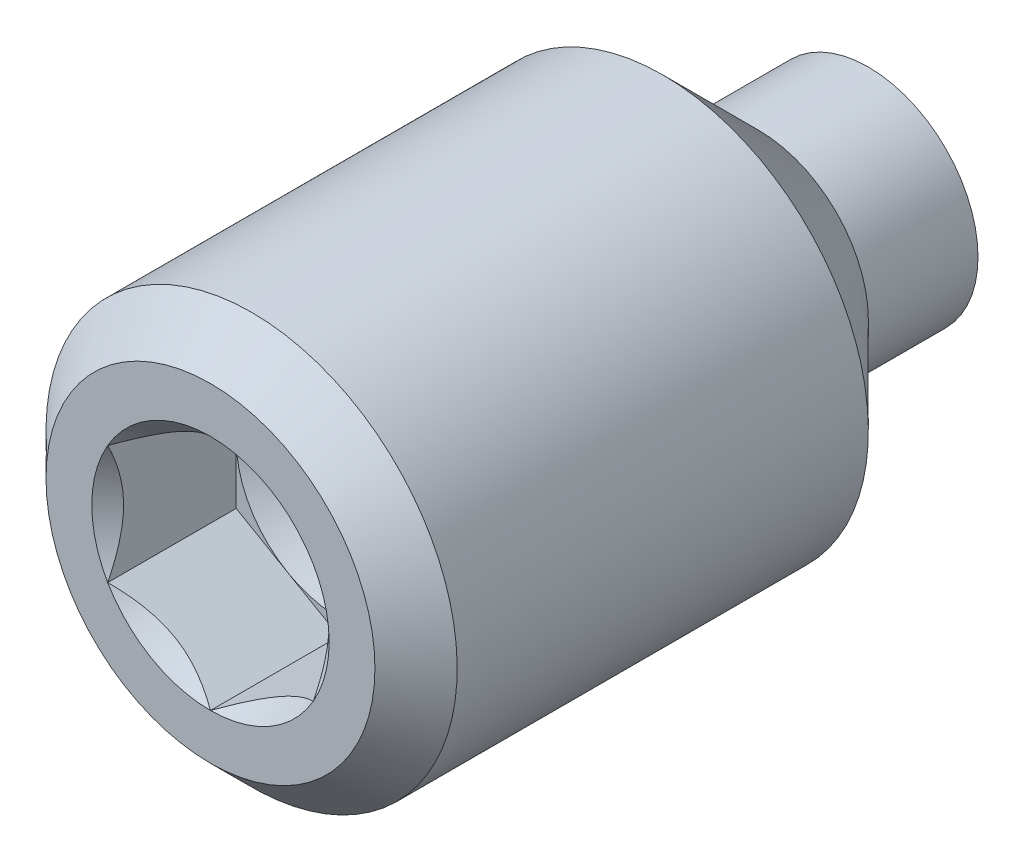
from build123d import *

# Parameters (mm, degrees)
CUT_EXTRUDE1_DEPTH = 0.9375


with BuildPart() as part:
    # Sketch22 → Revolve1 (revolve)
    with BuildSketch(Plane(origin=(0, 0, 0), x_dir=(0, 0, -1), z_dir=(1, 0, 0))):
        Polygon((-2.4, 0), (-2.4, 1.2), (-2.1, 1.5), (0.9, 1.5), (1.6, 0.8), (2.4, 0.8), (2.4, 0), align=None)
    revolve(axis=Axis((0, 0, -2.4), (0, 0, 1)))

    # Sketch30 → Cut-Extrude1 (cut)
    with BuildSketch(Plane.XY.offset(2.4)):
        Polygon((0.75, -0.433012702), (0.75, 0.433012702), (0, 0.866025404), (-0.75, 0.433012702), (-0.75, -0.433012702), (0, -0.866025404), align=None)
    extrude(amount=-CUT_EXTRUDE1_DEPTH, mode=Mode.SUBTRACT)

    # Cut-Extrude2 cone 1 section (through the dimple's axis) → Cut-Extrude2 (revolve, cut)
    with BuildSketch(Plane(origin=(0, 0, 2.4), x_dir=(0, -1, 0), z_dir=(1, 0, 0))):
        Polygon((0, 0), (0.866025404, 0), (0, 0.866025404), align=None)
    revolve(axis=Axis((0, 0, 2.4), (0, 0, -1)), mode=Mode.SUBTRACT)

    # Cut-Extrude3 cone 1 section (through the dimple's axis) → Cut-Extrude3 (revolve, cut)
    with BuildSketch(Plane(origin=(0, 0, 1.4625), x_dir=(0, -1, 0), z_dir=(1, 0, 0))):
        Polygon((0, 0), (0.75, 0), (0, 0.433012702), align=None)
    revolve(axis=Axis((0, 0, 1.4625), (0, 0, -1)), mode=Mode.SUBTRACT)


solid = part.part
